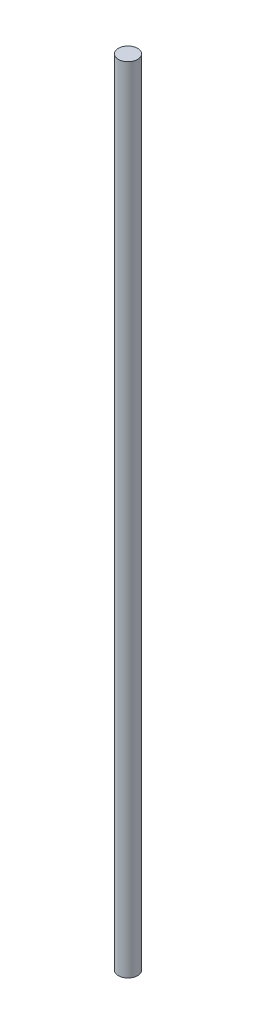
from build123d import *

# Parameters (mm, degrees)
SKETCH_1_R      = 2
EXTRUDE_1_DEPTH = 165


with BuildPart() as part:
    # 草图1 → 凸台-拉伸1 (new body)
    with BuildSketch(Plane(origin=(0, 0, 0), x_dir=(1, 0, 0), z_dir=(0, 1, 0))):
        with Locations(Location((0, 0, 0), (0, 0, 270))):
            Circle(SKETCH_1_R)
    extrude(amount=EXTRUDE_1_DEPTH)


solid = part.part
